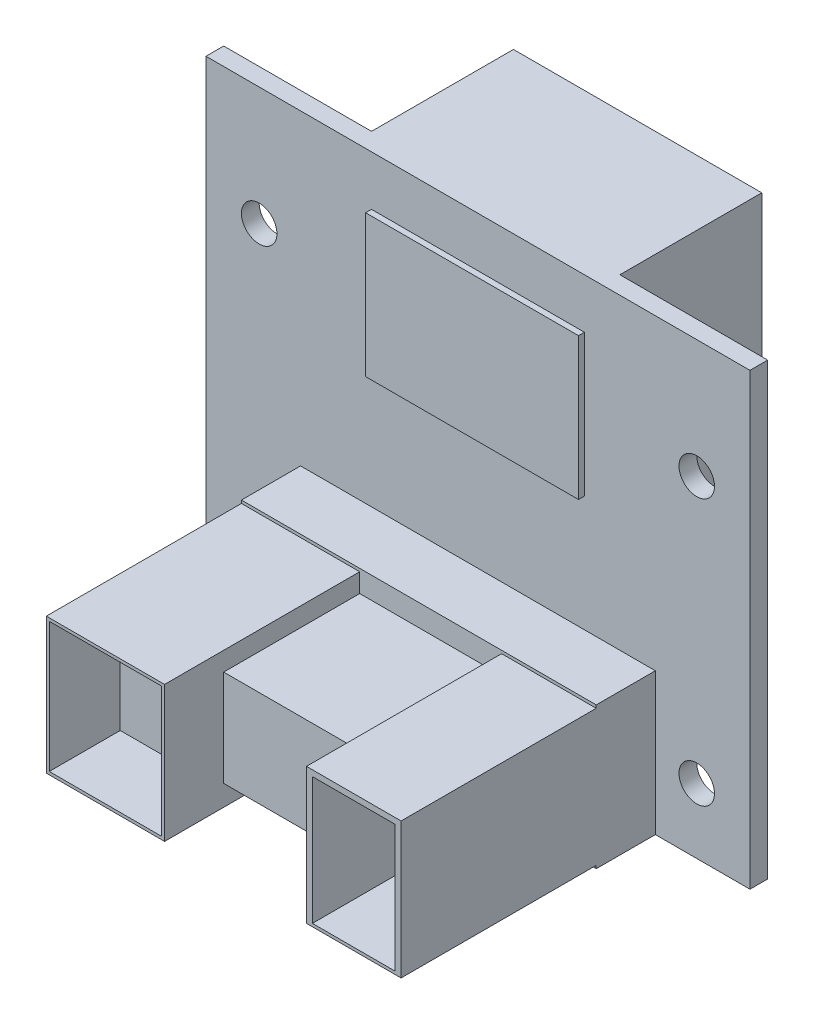
from build123d import *

# Parameters (mm, degrees)
SKETCH2_W            = 46
SKETCH2_H            = 38
SKETCH2_R            = 1.5
BOSS_EXTRUDE1_DEPTH  = 1.5
SKETCH12_W           = 21
SKETCH12_H           = 20
BOSS_EXTRUDE6_DEPTH  = 12
SKETCH13_W           = 18
SKETCH13_H           = 12
BOSS_EXTRUDE7_DEPTH  = 2
SKETCH15_W           = 30
SKETCH15_H           = 12
BOSS_EXTRUDE8_DEPTH  = 6.5
SKETCH16_W           = 10
SKETCH16_H           = 11.5
BOSS_EXTRUDE9_DEPTH  = 23
SKETCH17_W           = 8
SKETCH17_H           = 11.5
BOSS_EXTRUDE10_DEPTH = 23
SKETCH18_W           = 12
SKETCH18_H           = 8.151595729
BOSS_EXTRUDE11_DEPTH = 18
SKETCH19_W           = 9.5
SKETCH19_H           = 11
CUT_EXTRUDE3_DEPTH   = 16.5
SKETCH22_W           = 7
SKETCH22_H           = 10.75
CUT_EXTRUDE4_DEPTH   = 16.5


with BuildPart() as part:
    # Sketch2 → Boss-Extrude1 (new body)
    with BuildSketch(Plane.XY):
        with Locations((23, 19)):
            Rectangle(SKETCH2_W, SKETCH2_H)
        with Locations((4.5, 28)):
            Circle(SKETCH2_R, mode=Mode.SUBTRACT)
        with Locations((4.5, 5.5)):
            Circle(SKETCH2_R, mode=Mode.SUBTRACT)
        with Locations((41.5, 5.5)):
            Circle(SKETCH2_R, mode=Mode.SUBTRACT)
        with Locations((41.5, 28)):
            Circle(SKETCH2_R, mode=Mode.SUBTRACT)
    extrude(amount=BOSS_EXTRUDE1_DEPTH)

    # Sketch12 → Boss-Extrude6 (add)
    with BuildSketch(Plane.XY):
        with Locations((23, 28)):
            Rectangle(SKETCH12_W, SKETCH12_H)
    extrude(amount=-BOSS_EXTRUDE6_DEPTH)

    # Sketch13 → Boss-Extrude7 (add)
    with BuildSketch(Plane.XY):
        with Locations((23, 27.789125994)):
            Rectangle(SKETCH13_W, SKETCH13_H)
    extrude(amount=BOSS_EXTRUDE7_DEPTH)

    # Sketch15 → Boss-Extrude8 (add)
    with BuildSketch(Plane.XY):
        with Locations((23, 6)):
            Rectangle(SKETCH15_W, SKETCH15_H)
    extrude(amount=BOSS_EXTRUDE8_DEPTH)

    # Sketch16 → Boss-Extrude9 (add)
    with BuildSketch(Plane.XY):
        with Locations((13, 6)):
            Rectangle(SKETCH16_W, SKETCH16_H)
    extrude(amount=BOSS_EXTRUDE9_DEPTH)

    # Sketch17 → Boss-Extrude10 (add)
    with BuildSketch(Plane.XY):
        with Locations((34, 6)):
            Rectangle(SKETCH17_W, SKETCH17_H)
    extrude(amount=BOSS_EXTRUDE10_DEPTH)

    # Sketch18 → Boss-Extrude11 (add)
    with BuildSketch(Plane.XY):
        with Locations((24, 6.075797865)):
            Rectangle(SKETCH18_W, SKETCH18_H)
    extrude(amount=BOSS_EXTRUDE11_DEPTH)

    # Sketch19 → Cut-Extrude3 (cut)
    with BuildSketch(Plane.XY.offset(17)):
        with Locations((13, 6)):
            Rectangle(SKETCH19_W, SKETCH19_H)
    extrude(amount=CUT_EXTRUDE3_DEPTH, mode=Mode.SUBTRACT)

    # Sketch22 → Cut-Extrude4 (cut)
    with BuildSketch(Plane.XY.offset(12)):
        with Locations((34, 5.875)):
            Rectangle(SKETCH22_W, SKETCH22_H)
    extrude(amount=CUT_EXTRUDE4_DEPTH, mode=Mode.SUBTRACT)


solid = part.part
